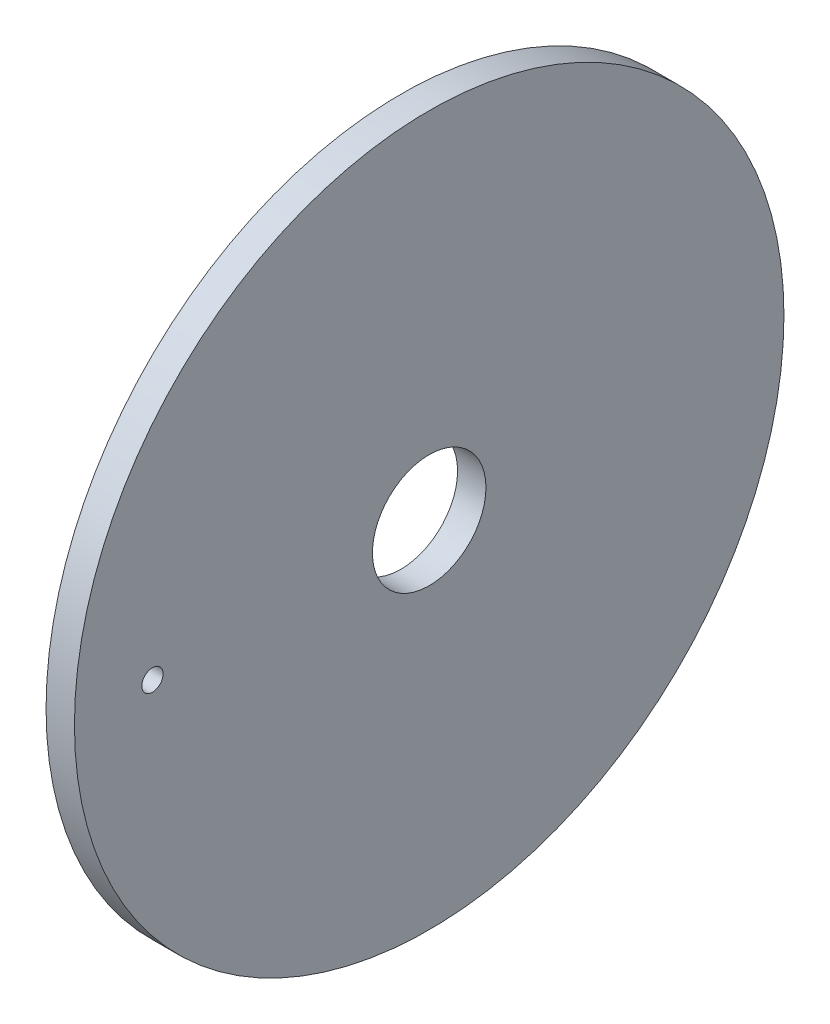
from build123d import *

# Parameters (mm, degrees)
SKETCH1_R           = 25
SKETCH1_R_2         = 4
BOSS_EXTRUDE1_DEPTH = 2
SKETCH2_R           = 0.75
CUT_EXTRUDE5_DEPTH  = 5


with BuildPart() as part:
    # Sketch1 → Boss-Extrude1 (new body)
    with BuildSketch(Plane(origin=(0, 0, 0), x_dir=(0, 0, -1), z_dir=(1, 0, 0))):
        Circle(SKETCH1_R)
        Circle(SKETCH1_R_2, mode=Mode.SUBTRACT)
    extrude(amount=BOSS_EXTRUDE1_DEPTH)

    # Sketch2 → Cut-Extrude5 (cut, symmetric)
    with BuildSketch(Plane(origin=(0, 0, 0), x_dir=(0, 0, -1), z_dir=(1, 0, 0))):
        with Locations((-19.5, 0)):
            Circle(SKETCH2_R)
    extrude(amount=CUT_EXTRUDE5_DEPTH, both=True, mode=Mode.SUBTRACT)


solid = part.part
